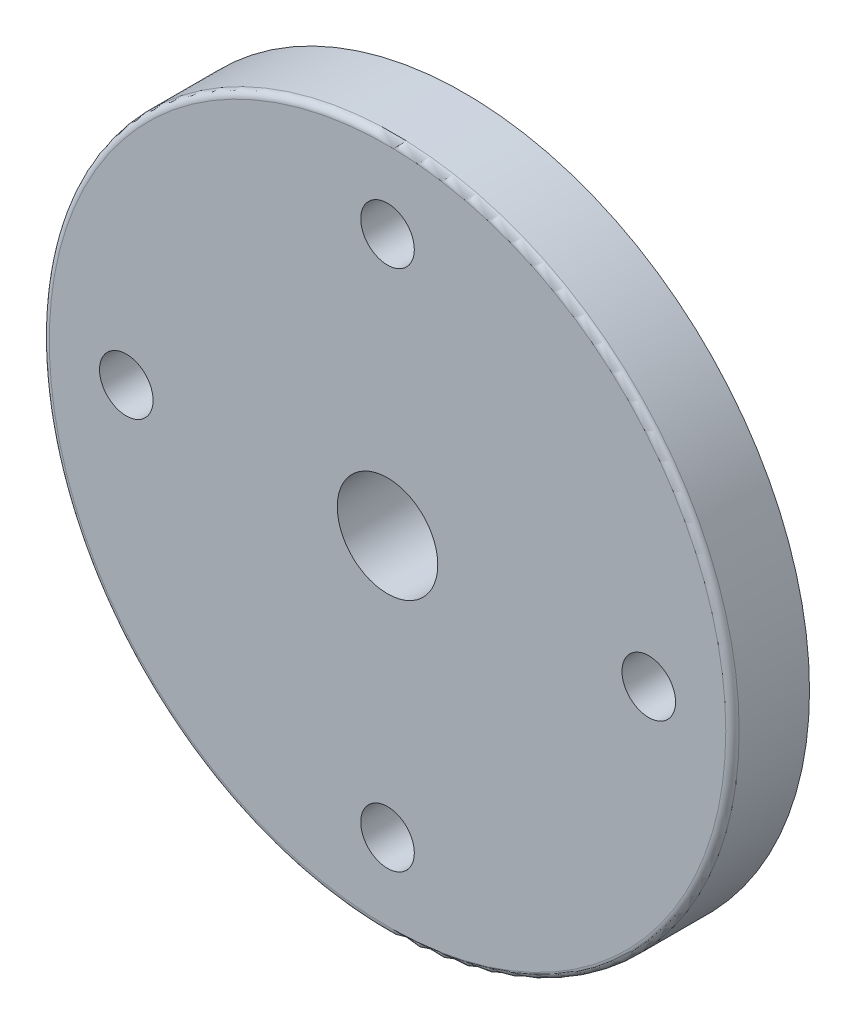
from build123d import *

# Parameters (mm, degrees)
SKETCH1_R           = 10.3
BOSS_EXTRUDE1_DEPTH = 2.3
SKETCH2_R           = 4.375
BOSS_EXTRUDE2_DEPTH = 3.2
SKETCH3_R           = 3
CUT_EXTRUDE1_DEPTH  = 2.75
SKETCH4_R           = 1.5
CUT_EXTRUDE2_DEPTH  = 16.570163776
SKETCH12_R          = 0.8
CUT_EXTRUDE10_DEPTH = 15.913752043
FILLET2_R           = 0.2
FILLET3_R           = 0.3


with BuildPart() as part:
    # Sketch1 → Boss-Extrude1 (new body)
    with BuildSketch(Plane(origin=(0, 0, -2.5), x_dir=(-1, 0, 0), z_dir=(0, 0, -1))):
        with Locations(Location((0, 0, 0), (0, 0, 180))):
            Circle(SKETCH1_R)
    extrude(amount=-BOSS_EXTRUDE1_DEPTH)

    # Sketch2 → Boss-Extrude2 (add)
    with BuildSketch(Plane(origin=(0, 0, -2.5), x_dir=(-1, 0, 0), z_dir=(0, 0, -1))):
        Circle(SKETCH2_R)
    extrude(amount=BOSS_EXTRUDE2_DEPTH)

    # Sketch3 → Cut-Extrude1 (cut)
    with BuildSketch(Plane(origin=(0, 0, -5.7), x_dir=(-1, 0, 0), z_dir=(0, 0, -1))):
        with Locations(Location((0, 0, 0), (0, 0, 180))):
            Circle(SKETCH3_R)
    extrude(amount=-CUT_EXTRUDE1_DEPTH, mode=Mode.SUBTRACT)

    # Sketch4 → Cut-Extrude2 (cut, through all)
    with BuildSketch(Plane.XY.offset(-0.2)):
        Circle(SKETCH4_R)
    extrude(amount=-CUT_EXTRUDE2_DEPTH, mode=Mode.SUBTRACT)

    # Sketch12 → Cut-Extrude10 (cut, through all)
    with BuildSketch(Plane(origin=(0, 0, -2.5), x_dir=(-1, 0, 0), z_dir=(0, 0, -1))):
        with Locations(Location((0, 7.8, 0), (0, 0, 180))):
            Circle(SKETCH12_R)
        with Locations(Location((7.8, 0, 0), (0, 0, 180))):
            Circle(SKETCH12_R)
        with Locations(Location((0, -7.8, 0), (0, 0, 180))):
            Circle(SKETCH12_R)
        with Locations(Location((-7.8, 0, 0), (0, 0, 180))):
            Circle(SKETCH12_R)
    extrude(amount=-CUT_EXTRUDE10_DEPTH, mode=Mode.SUBTRACT)

    # Fillet2
    fillet2_edges = [part.edges().sort_by_distance(p)[0] for p in [
        (-10.3, 0, -0.2),
    ]]
    fillet(fillet2_edges, radius=FILLET2_R)

    # Fillet3
    fillet3_edges = [part.edges().sort_by_distance(p)[0] for p in [
        (4.375, 0, -5.7),
    ]]
    fillet(fillet3_edges, radius=FILLET3_R)


solid = part.part
